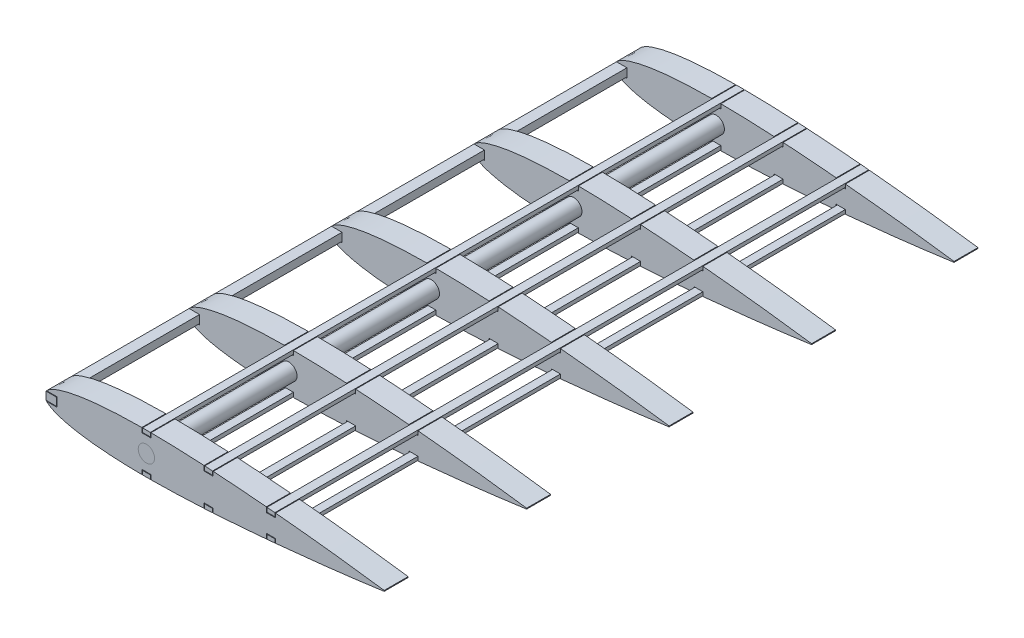
from build123d import *

# Parameters (mm, degrees)
BOSS_EXTRUDE1_DEPTH      = 6.35
BOSS_EXTRUDE1_DEPTH_BACK = 3.175
CUT_EXTRUDE1_DEPTH       = 136.39191192
CUT_EXTRUDE1_DEPTH_BACK  = 136.39191192
SKETCH5_R                = 3.24
SKETCH5_W                = 3.632824666
SKETCH5_H                = 3.632824666
SKETCH5_W_2              = 10
LPATTERN1_COUNT          = 5
LPATTERN1_PITCH          = 56.6175
BOSS_EXTRUDE2_DEPTH      = 232.825
BOSS_EXTRUDE2_DEPTH_BACK = 3.175
SKETCH8_R                = 3.24
SKETCH8_W                = 4.142763537
SKETCH8_H                = 3.132824666


with BuildPart() as part:
    # Sketch4 → Boss-Extrude1 (new, two sides: drawn at the far end of the back side and taken through both)
    with BuildSketch(Plane.XY.offset(-BOSS_EXTRUDE1_DEPTH_BACK)):
        with BuildLine():
            Line((135, -0.1701), (135, 0.1701))
            add(Edge.make_bspline(
                [(135, 0.1701), (134.973720181, 0.173791293), (134.868695356, 0.1885432), (134.632579367, 0.221566273), (134.239699295, 0.276483263), (133.690953175, 0.352877672), (132.987587672, 0.449877373), (132.131326384, 0.567603073), (131.124072458, 0.704781458), (129.968213163, 0.860524037), (128.66648579, 1.03416482), (127.221915884, 1.224457167), (125.637869337, 1.430507216), (123.918012935, 1.650661024), (122.066391197, 1.884361853), (120.087314948, 2.129974639), (117.985424406, 2.38622907), (115.76564404, 2.651981273), (113.433143287, 2.925842631), (110.99328411, 3.206172588), (108.451903755, 3.492255227), (105.814857941, 3.782038326), (103.088389211, 4.074743588), (100.278758549, 4.368279288), (97.392588828, 4.662101467), (94.436585345, 4.953944434), (91.417698496, 5.242891581), (88.342938685, 5.526936046), (85.219478572, 5.805149177), (82.054632247, 6.075231029), (78.855775059, 6.335973554), (75.630418532, 6.585711608), (72.386054472, 6.822440418), (69.130307275, 7.044675244), (65.870777015, 7.250640913), (62.615008481, 7.438348274), (59.370666024, 7.606312931), (56.145252874, 7.752701188), (52.946328491, 7.875882298), (49.781411903, 7.97448872), (46.657871713, 8.046766458), (43.583000073, 8.091441323), (40.563903645, 8.107257661), (37.607692873, 8.093275637), (34.721286401, 8.048866613), (31.911448005, 7.972688507), (29.184677549, 7.86507842), (26.547337595, 7.725263151), (24.005568205, 7.553634579), (21.565354673, 7.350228492), (19.232370347, 7.115414583), (17.012035994, 6.85008361), (14.909470352, 6.555314071), (12.929626566, 6.231655441), (11.077042063, 5.880725314), (9.355980537, 5.503843239), (7.770464249, 5.102286809), (6.323996694, 4.677854931), (5.019767333, 4.231957139), (3.860557504, 3.766133468), (2.848661918, 3.281727731), (1.986008366, 2.779748437), (1.273601374, 2.261046539), (0.712817504, 1.724768801), (0.305009103, 1.16939604), (0.055674403, 0.592213656), (-0.027138035, 0), (0.055674403, -0.592213656), (0.305009103, -1.16939604), (0.712817504, -1.724768801), (1.273601374, -2.261046539), (1.986008366, -2.779748437), (2.848661918, -3.281727731), (3.860557504, -3.766133468), (5.019767333, -4.231957139), (6.323996694, -4.677854931), (7.770464249, -5.102286809), (9.355980537, -5.503843239), (11.077042063, -5.880725314), (12.929626566, -6.231655441), (14.909470352, -6.555314071), (17.012035994, -6.85008361), (19.232370347, -7.115414583), (21.565354673, -7.350228492), (24.005568205, -7.553634579), (26.547337595, -7.725263151), (29.184677549, -7.86507842), (31.911448005, -7.972688507), (34.721286401, -8.048866613), (37.607692873, -8.093275637), (40.563903645, -8.107257661), (43.583000073, -8.091441323), (46.657871713, -8.046766458), (49.781411903, -7.97448872), (52.946328491, -7.875882298), (56.145252874, -7.752701188), (59.370666024, -7.606312931), (62.615008481, -7.438348274), (65.870777015, -7.250640913), (69.130307275, -7.044675244), (72.386054472, -6.822440418), (75.630418532, -6.585711608), (78.855775059, -6.335973554), (82.054632247, -6.075231029), (85.219478572, -5.805149177), (88.342938685, -5.526936046), (91.417698496, -5.242891581), (94.436585345, -4.953944434), (97.392588828, -4.662101467), (100.278758549, -4.368279288), (103.088389211, -4.074743588), (105.814857941, -3.782038326), (108.451903755, -3.492255227), (110.99328411, -3.206172588), (113.433143287, -2.925842631), (115.76564404, -2.651981273), (117.985424406, -2.38622907), (120.087314948, -2.129974639), (122.066391197, -1.884361853), (123.918012935, -1.650661024), (125.637869337, -1.430507216), (127.221915884, -1.224457167), (128.66648579, -1.03416482), (129.968213163, -0.860524037), (131.124072458, -0.704781458), (132.131326384, -0.567603073), (132.987587672, -0.449877373), (133.690953175, -0.352877672), (134.239699295, -0.276483263), (134.632579367, -0.221566273), (134.868695356, -0.1885432), (134.973720181, -0.173791293), (135, -0.1701)],
                knots=[0, 0, 0, 0, 0.000289201, 0.001155766, 0.002598169, 0.004612322, 0.007193518, 0.010335793, 0.014031397, 0.018271612, 0.023045847, 0.028342901, 0.03415012, 0.04045376, 0.04723833, 0.054488645, 0.062186613, 0.070313724, 0.078851908, 0.087780126, 0.097077521, 0.106722049, 0.116690868, 0.126960505, 0.137507218, 0.148306055, 0.159330765, 0.17055649, 0.181956531, 0.193504043, 0.205171367, 0.2169323, 0.228758169, 0.2406214, 0.252494936, 0.264350287, 0.276160573, 0.287897994, 0.299535854, 0.311047092, 0.322404759, 0.333584032, 0.344559266, 0.35530596, 0.365799778, 0.37601757, 0.3859373, 0.395537659, 0.404797976, 0.413698812, 0.422221441, 0.430349273, 0.438066019, 0.445356904, 0.452209372, 0.458611567, 0.464554044, 0.47002985, 0.475034902, 0.479569141, 0.483636857, 0.487250263, 0.490431338, 0.493218828, 0.495674086, 0.497891368, 0.5, 0.502108632, 0.504325914, 0.506781172, 0.509568662, 0.512749737, 0.516363143, 0.520430859, 0.524965098, 0.52997015, 0.535445956, 0.541388433, 0.547790628, 0.554643096, 0.561933981, 0.569650727, 0.577778559, 0.586301188, 0.595202024, 0.604462341, 0.6140627, 0.62398243, 0.634200222, 0.64469404, 0.655440734, 0.666415968, 0.677595241, 0.688952908, 0.700464146, 0.712102006, 0.723839427, 0.735649713, 0.747505064, 0.7593786, 0.771241831, 0.7830677, 0.794828633, 0.806495957, 0.818043469, 0.82944351, 0.840669235, 0.851693945, 0.862492782, 0.873039495, 0.883309132, 0.893277951, 0.902922479, 0.912219874, 0.921148092, 0.929686276, 0.937813387, 0.945511355, 0.95276167, 0.95954624, 0.96584988, 0.971657099, 0.976954153, 0.981728388, 0.985968603, 0.989664207, 0.992806482, 0.995387678, 0.997401831, 0.998844234, 0.999710799, 1, 1, 1, 1], degree=3))
        make_face()
    extrude(amount=BOSS_EXTRUDE1_DEPTH + BOSS_EXTRUDE1_DEPTH_BACK)

    # Sketch5 → Cut-Extrude1 (cut, two sides: drawn at the far end of the back side and taken through both)
    with BuildSketch(Plane.XY.offset(-CUT_EXTRUDE1_DEPTH_BACK)):
        with Locations((40.5, 0)):
            Circle(SKETCH5_R)
        with Locations((40.5, 8.102300601)):
            Rectangle(SKETCH5_W, SKETCH5_H)
        with Locations((40.5, -8.102300601)):
            Rectangle(SKETCH5_W, SKETCH5_H)
        Rectangle(SKETCH5_W_2, SKETCH5_H)
        with Locations((90, 5.37342497)):
            Rectangle(SKETCH5_W, SKETCH5_H)
        with Locations((90, -5.37342497)):
            Rectangle(SKETCH5_W, SKETCH5_H)
        with Locations((65.25, 7.284813411)):
            Rectangle(SKETCH5_W, SKETCH5_H)
        with Locations((65.25, -7.284813411)):
            Rectangle(SKETCH5_W, SKETCH5_H)
    extrude(amount=CUT_EXTRUDE1_DEPTH + CUT_EXTRUDE1_DEPTH_BACK, mode=Mode.SUBTRACT)


with BuildPart() as lpattern1_1:
    # LPattern1: pattern copy
    add(part.part.moved(Location(Vector(0, 0, 1) * (1 * LPATTERN1_PITCH))))


with BuildPart() as lpattern1_2:
    # LPattern1: pattern copy
    add(part.part.moved(Location(Vector(0, 0, 1) * (2 * LPATTERN1_PITCH))))


with BuildPart() as lpattern1_3:
    # LPattern1: pattern copy
    add(part.part.moved(Location(Vector(0, 0, 1) * (3 * LPATTERN1_PITCH))))


with BuildPart() as lpattern1_4:
    # LPattern1: pattern copy
    add(part.part.moved(Location(Vector(0, 0, 1) * (4 * LPATTERN1_PITCH))))


with BuildPart() as part_1:
    add(part.part)

    add(lpattern1_1.part)  # Boss-Extrude2 merges LPattern1_1

    add(lpattern1_2.part)  # Boss-Extrude2 merges LPattern1_2

    add(lpattern1_3.part)  # Boss-Extrude2 merges LPattern1_3

    add(lpattern1_4.part)  # Boss-Extrude2 merges LPattern1_4
    # Sketch8 → Boss-Extrude2 (add, two sides: drawn at the far end of the back side and taken through both)
    with BuildSketch(Plane.XY.offset(-BOSS_EXTRUDE2_DEPTH_BACK)):
        with Locations((40.5, 0)):
            Circle(SKETCH8_R)
        with Locations((2.678618231, 0)):
            Rectangle(SKETCH8_W, SKETCH8_H)
        Polygon((38.933587676, 8.098229773), (38.933587676, 6.535888268), (42.066412333, 6.535888268), (42.066412333, 8.098174102), align=None)
        Polygon((63.683587667, 7.375667381), (63.683587667, 5.718401078), (66.816412333, 5.718401078), (66.816412333, 7.189743495), align=None)
        Polygon((88.433587657, 5.516998197), (88.433587657, 3.807012637), (91.566412333, 3.807012637), (91.566412333, 5.22720004), align=None)
        Polygon((38.933587667, -6.535888268), (38.933587667, -8.098229773), (42.066412333, -8.098174102), (42.066412333, -6.535888268), align=None)
        Polygon((63.683587667, -5.718401078), (63.683587667, -7.375667381), (66.816412333, -7.189743495), (66.816412333, -5.718401078), align=None)
        Polygon((88.433587667, -3.807012637), (88.433587667, -5.516998196), (91.566412333, -5.22720004), (91.566412333, -3.807012637), align=None)
    extrude(amount=BOSS_EXTRUDE2_DEPTH + BOSS_EXTRUDE2_DEPTH_BACK)


solid = part_1.part
